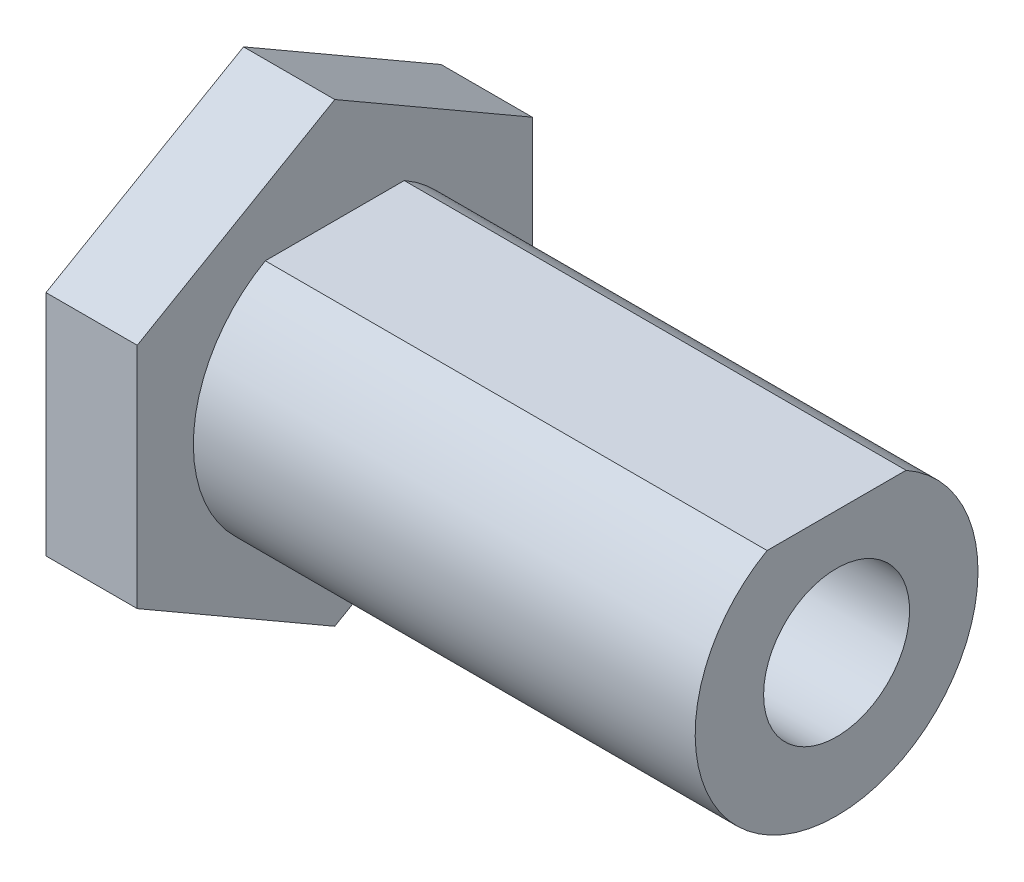
from build123d import *

# Parameters (mm, degrees)
SKETCH2_OUTSIDE_W  = 15.842
SKETCH2_OUTSIDE_H  = 15.842
CUT_EXTRUDE1_DEPTH = 10
SHELL1_T           = -1.5
CUT_EXTRUDE2_DEPTH = 11


with BuildPart() as part:
    # Sketch1 → Revolve1 (revolve)
    with BuildSketch(Plane.XY, mode=Mode.PRIVATE) as revolve1_sk:
        Polygon((0, 0), (0, 5), (2, 5), (2, 3.1), (13, 3.1), (13, 0), align=None)
    revolve(revolve1_sk.sketch.rotate(Axis((0, 0, 0), (1, 0, 0)), 90), axis=Axis((0, 0, 0), (1, 0, 0)))

    # Sketch2 outside → Cut-Extrude1 (cut)
    with BuildSketch(Plane.ZY):
        Rectangle(SKETCH2_OUTSIDE_W, SKETCH2_OUTSIDE_H)
        Polygon((0, -5), (4.330127019, -2.5), (4.330127019, 2.5), (0, 5), (-4.330127019, 2.5), (-4.330127019, -2.5), align=None, mode=Mode.SUBTRACT)
    extrude(amount=-CUT_EXTRUDE1_DEPTH, mode=Mode.SUBTRACT)

    # Shell1
    shell1_openings = [part.faces().sort_by_distance(p)[0] for p in [
        (13, 0, 0),
    ]]
    offset(amount=SHELL1_T, openings=shell1_openings, kind=Kind.INTERSECTION)

    # Sketch3 → Cut-Extrude2 (cut)
    with BuildSketch(Plane(origin=(13, 0, 0), x_dir=(0, 0, -1), z_dir=(1, 0, 0))):
        with BuildLine():
            Line((1.523154621, 2.7), (-1.523154621, 2.7))
            ThreePointArc((-1.523154621, 2.7), (0, 3.1), (1.523154621, 2.7))
        make_face()
    extrude(amount=-CUT_EXTRUDE2_DEPTH, mode=Mode.SUBTRACT)


solid = part.part
